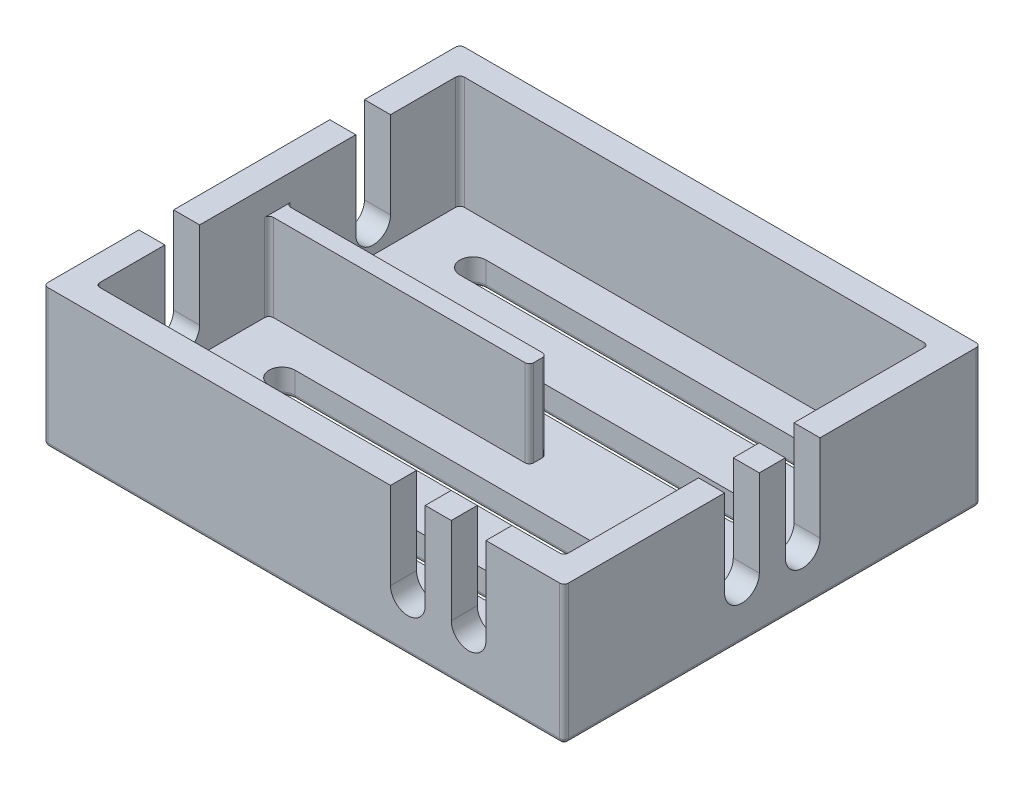
from build123d import *

# Parameters (mm, degrees)
SKETCH1_W           = 60
SKETCH1_H           = 48
BOSS_EXTRUDE1_DEPTH = 13
SKETCH2_W           = 60
SKETCH2_H           = 48
BOSS_EXTRUDE2_DEPTH = 3
SKETCH3_W           = 54
SKETCH3_H           = 42
CUT_EXTRUDE1_DEPTH  = 13
CUT_EXTRUDE2_DEPTH  = 3
SKETCH5_W           = 30
SKETCH5_H           = 2
BOSS_EXTRUDE3_DEPTH = 10
CUT_EXTRUDE3_DEPTH  = 64.198101237
CUT_EXTRUDE4_DEPTH  = 10
CUT_EXTRUDE5_DEPTH  = 10
FILLET1_R           = 0.5


with BuildPart() as part:
    # Sketch1 → Boss-Extrude1 (new body)
    with BuildSketch(Plane(origin=(0, 0, 0), x_dir=(1, 0, 0), z_dir=(0, 1, 0))):
        Rectangle(SKETCH1_W, SKETCH1_H)
    extrude(amount=BOSS_EXTRUDE1_DEPTH)

    # Sketch2 → Boss-Extrude2 (add)
    with BuildSketch(Plane.XZ):
        Rectangle(SKETCH2_W, SKETCH2_H)
    extrude(amount=BOSS_EXTRUDE2_DEPTH)

    # Sketch3 → Cut-Extrude1 (cut)
    with BuildSketch(Plane(origin=(0, 13, 0), x_dir=(1, 0, 0), z_dir=(0, 1, 0))):
        Rectangle(SKETCH3_W, SKETCH3_H)
    extrude(amount=-CUT_EXTRUDE1_DEPTH, mode=Mode.SUBTRACT)

    # Sketch4 → Cut-Extrude2 (cut)
    with BuildSketch(Plane(origin=(27, 0, 39), x_dir=(0, 0, 1), z_dir=(-1, 0, 0))):
        with BuildLine():
            Line((-37.5, 3), (-37.5, 13))
            Line((-37.5, 13), (-33.5, 13))
            Line((-33.5, 13), (-33.5, 3))
            ThreePointArc((-33.5, 3), (-35.5, 1), (-37.5, 3))
        make_face()
        with BuildLine():
            Line((-40.5, 3), (-40.5, 13))
            Line((-40.5, 13), (-44.5, 13))
            Line((-44.5, 13), (-44.5, 3))
            ThreePointArc((-44.5, 3), (-42.5, 1), (-40.5, 3))
        make_face()
    extrude(amount=-CUT_EXTRUDE2_DEPTH, mode=Mode.SUBTRACT)

    # Sketch5 → Boss-Extrude3 (add)
    with BuildSketch(Plane(origin=(0, 0, 0), x_dir=(1, 0, 0), z_dir=(0, 1, 0))):
        with Locations((-12, 0)):
            Rectangle(SKETCH5_W, SKETCH5_H)
    extrude(amount=BOSS_EXTRUDE3_DEPTH)

    # Sketch6 → Cut-Extrude3 (cut, through all)
    with BuildSketch(Plane(origin=(-27, 0, 0), x_dir=(0, 0, -1), z_dir=(1, 0, 0))):
        with BuildLine():
            Line((-13, 3), (-13, 13))
            Line((-13, 13), (-9, 13))
            Line((-9, 13), (-9, 3))
            ThreePointArc((-9, 3), (-11, 1), (-13, 3))
        make_face()
    cut_extrude3 = extrude(amount=-CUT_EXTRUDE3_DEPTH, mode=Mode.SUBTRACT)

    # Mirror1: Cut-Extrude3 across plane
    add(cut_extrude3.mirror(Plane.XY), mode=Mode.SUBTRACT)

    # Sketch7 → Cut-Extrude4 (cut)
    with BuildSketch(Plane(origin=(0, 0, 21), x_dir=(-1, 0, 0), z_dir=(0, 0, -1))):
        with BuildLine():
            Line((-14, 3), (-14, 13))
            Line((-14, 13), (-10, 13))
            Line((-10, 13), (-10, 3))
            ThreePointArc((-10, 3), (-12, 1), (-14, 3))
        make_face()
        with BuildLine():
            Line((-17, 3), (-17, 13))
            Line((-17, 13), (-21, 13))
            Line((-21, 13), (-21, 3))
            ThreePointArc((-21, 3), (-19, 1), (-17, 3))
        make_face()
    extrude(amount=-CUT_EXTRUDE4_DEPTH, mode=Mode.SUBTRACT)

    # Sketch11 → Cut-Extrude5 (cut)
    with BuildSketch(Plane(origin=(0, 0, 0), x_dir=(1, 0, 0), z_dir=(0, 1, 0))):
        with BuildLine():
            Line((-20, 5), (20, 5))
            ThreePointArc((20, 5), (21.5, 6.5), (20, 8))
            Line((20, 8), (-20, 8))
            ThreePointArc((-20, 8), (-21.5, 6.5), (-20, 5))
        make_face()
        with BuildLine():
            Line((-20, 14), (20, 14))
            ThreePointArc((20, 14), (21.5, 15.5), (20, 17))
            Line((20, 17), (-20, 17))
            ThreePointArc((-20, 17), (-21.5, 15.5), (-20, 14))
        make_face()
        with BuildLine():
            Line((-20, -5), (20, -5))
            ThreePointArc((20, -5), (21.5, -6.5), (20, -8))
            Line((20, -8), (-20, -8))
            ThreePointArc((-20, -8), (-21.5, -6.5), (-20, -5))
        make_face()
        with BuildLine():
            Line((-20, -17), (20, -17))
            ThreePointArc((20, -17), (21.5, -15.5), (20, -14))
            Line((20, -14), (-20, -14))
            ThreePointArc((-20, -14), (-21.5, -15.5), (-20, -17))
        make_face()
    extrude(amount=-CUT_EXTRUDE5_DEPTH, mode=Mode.SUBTRACT)

    # Fillet1
    fillet1_edges = [part.edges().sort_by_distance(p)[0] for p in [
        (0, -3, 17),
        (21.5, -3, 15.5),
        (0, -3, 14),
        (-21.5, -3, 15.5),
        (0, -3, -5),
        (21.5, -3, -6.5),
        (0, -3, -8),
        (-21.5, -3, -6.5),
        (0, -3, 8),
        (21.5, -3, 6.5),
        (0, -3, 5),
        (-21.5, -3, 6.5),
        (-30, -3, 0),
        (0, -3, -17),
        (-21.5, -3, -15.5),
        (0, -3, -14),
        (21.5, -3, -15.5),
        (0, -3, -24),
        (30, -3, 0),
        (0, -3, 24),
        (-27, 6.5, 21),
        (-27, 6.5, -21),
        (27, 6.5, -21),
        (27, 6.5, 21),
        (-27, 5, -1),
        (-27, 5, 1),
        (3, 5, 1),
        (3, 5, -1),
        (-30, 5, -24),
        (30, 5, -24),
        (30, 5, 24),
        (-30, 5, 24),
    ]]
    fillet(fillet1_edges, radius=FILLET1_R)


solid = part.part
